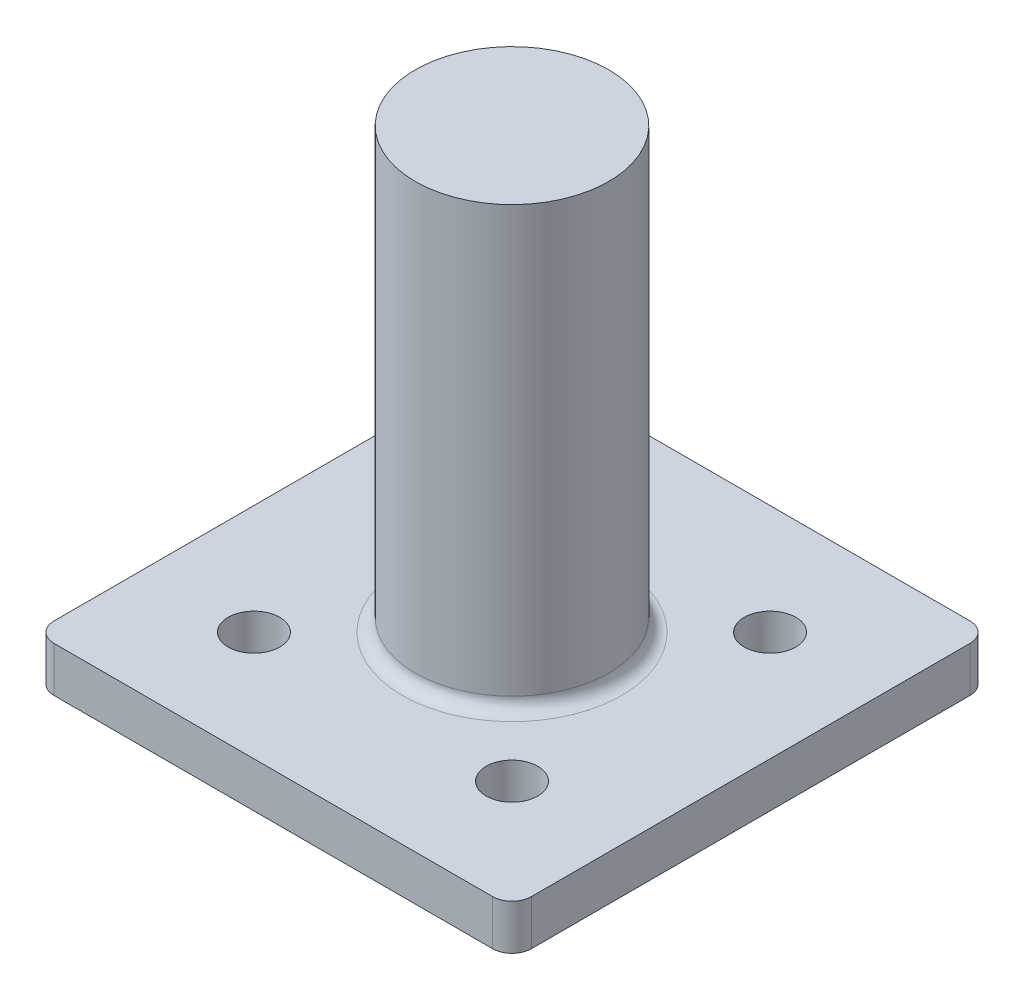
from build123d import *

# Parameters (mm, degrees)
BOSS_EXTRUDE1_DEPTH = 7
SKETCH2_R           = 15
BOSS_EXTRUDE2_DEPTH = 68
FILLET1_R           = 2
SKETCH3_R           = 4
CUT_EXTRUDE1_DEPTH  = 10


with BuildPart() as part:
    # Sketch1 → Boss-Extrude1 (new body)
    with BuildSketch(Plane(origin=(0, 0, 0), x_dir=(1, 0, 0), z_dir=(0, 1, 0))):
        with BuildLine():
            Line((3, 0), (71, 0))
            ThreePointArc((71, 0), (73.121320344, 0.878679656), (74, 3))
            Line((74, 3), (74, 71))
            ThreePointArc((74, 71), (73.121320344, 73.121320344), (71, 74))
            Line((71, 74), (3, 74))
            ThreePointArc((3, 74), (0.878679656, 73.121320344), (0, 71))
            Line((0, 71), (0, 3))
            ThreePointArc((0, 3), (0.878679656, 0.878679656), (3, 0))
        make_face()
    extrude(amount=BOSS_EXTRUDE1_DEPTH)

    # Sketch2 → Boss-Extrude2 (add)
    with BuildSketch(Plane(origin=(0, 7, 0), x_dir=(1, 0, 0), z_dir=(0, 1, 0))):
        with Locations(Location((37, 37, 0), (0, 0, 270))):
            Circle(SKETCH2_R)
    extrude(amount=BOSS_EXTRUDE2_DEPTH)

    # Fillet1
    fillet1_edges = [part.edges().sort_by_distance(p)[0] for p in [
        (37, 7, -52),
    ]]
    fillet(fillet1_edges, radius=FILLET1_R)

    # Sketch3 → Cut-Extrude1 (cut)
    with BuildSketch(Plane(origin=(0, 7, 0), x_dir=(1, 0, 0), z_dir=(0, 1, 0))):
        with Locations(Location((17, 17, 0), (0, 0, 270))):
            Circle(SKETCH3_R)
        with Locations(Location((57, 17, 0), (0, 0, 270))):
            Circle(SKETCH3_R)
    cut_extrude1 = extrude(amount=-CUT_EXTRUDE1_DEPTH, mode=Mode.SUBTRACT)

    # Mirror1: Cut-Extrude1 across plane
    add(cut_extrude1.mirror(Plane.XY.offset(-37)), mode=Mode.SUBTRACT)


solid = part.part
